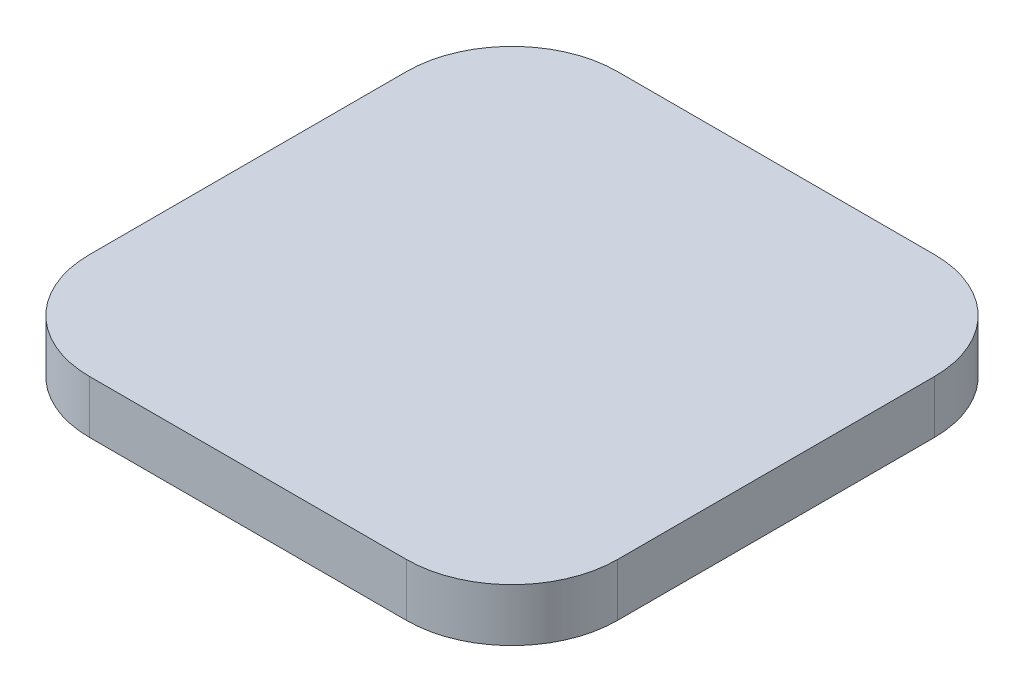
from build123d import *

# Parameters (mm, degrees)
SKETCH1_W           = 50.8
SKETCH1_H           = 50.8
BOSS_EXTRUDE1_DEPTH = 5.08
FILLET1_R           = 10.16


with BuildPart() as part:
    # Sketch1 → Boss-Extrude1 (new body)
    with BuildSketch(Plane(origin=(0, 0, 0), x_dir=(1, 0, 0), z_dir=(0, 1, 0))):
        Rectangle(SKETCH1_W, SKETCH1_H)
    extrude(amount=BOSS_EXTRUDE1_DEPTH)

    # Fillet1
    fillet1_edges = [part.edges().sort_by_distance(p)[0] for p in [
        (25.4, 2.54, 25.4),
        (-25.4, 2.54, 25.4),
        (-25.4, 2.54, -25.4),
        (25.4, 2.54, -25.4),
    ]]
    fillet(fillet1_edges, radius=FILLET1_R)


solid = part.part
